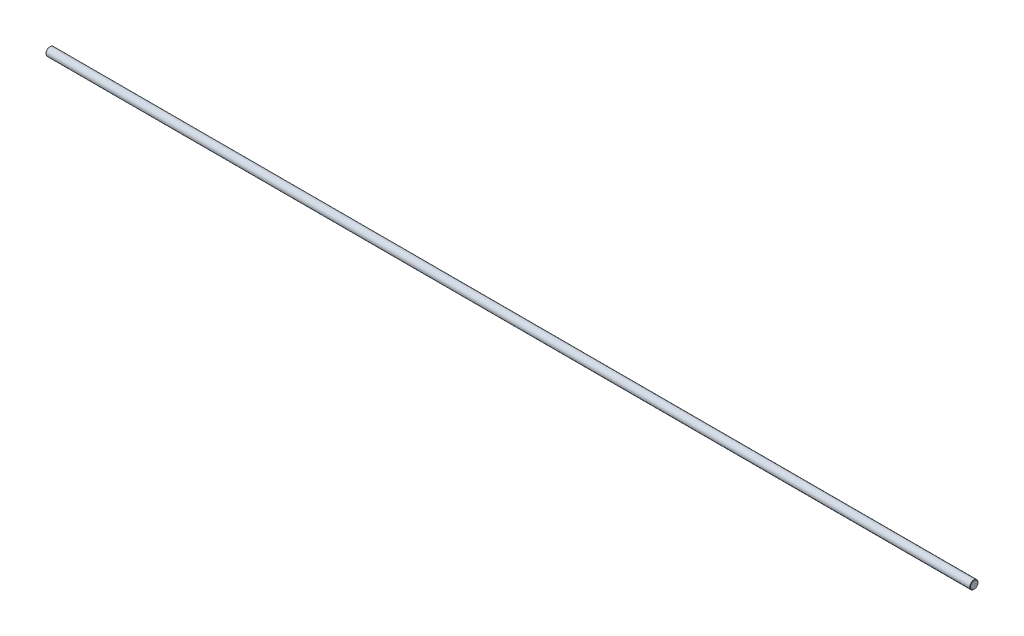
from build123d import *

# Parameters (mm, degrees)
SKETCH2_R           = 6
BOSS_EXTRUDE1_DEPTH = 1340
CHAMFER1_SIZE       = 0.5


with BuildPart() as part:
    # Sketch2 → Boss-Extrude1 (new body)
    with BuildSketch(Plane(origin=(0, 0, 0), x_dir=(0, 0, -1), z_dir=(1, 0, 0))):
        Circle(SKETCH2_R)
    extrude(amount=BOSS_EXTRUDE1_DEPTH)

    # Chamfer1
    chamfer1_edges = [part.edges().sort_by_distance(p)[0] for p in [
        (0, 0, 6),
        (1340, 0, 6),
    ]]
    chamfer(chamfer1_edges, length=CHAMFER1_SIZE)


solid = part.part
